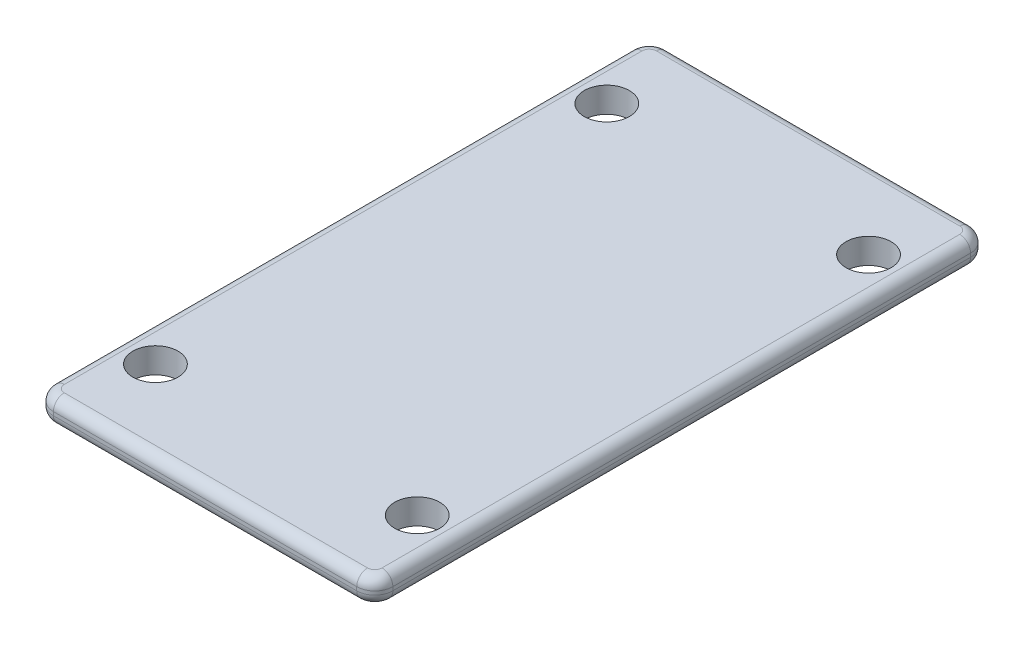
from build123d import *

# Parameters (mm, degrees)
SKETCH1_W                 = 18.8
SKETCH1_H                 = 34
SKETCH1_R                 = 1.25
CABLE_PLATE_EXTRUDE_DEPTH = 1.4
FILLET2_R                 = 1
FILLET1_R                 = 0.6


with BuildPart() as part:
    # Sketch1 → Cable Plate Extrude (new body)
    with BuildSketch(Plane(origin=(0, 0, 0), x_dir=(1, 0, 0), z_dir=(0, 1, 0))):
        Rectangle(SKETCH1_W, SKETCH1_H)
        with Locations(Location((-7.25, 12.5, 0), (0, 0, 270))):
            Circle(SKETCH1_R, mode=Mode.SUBTRACT)
        with Locations(Location((7.25, 12.5, 0), (0, 0, 270))):
            Circle(SKETCH1_R, mode=Mode.SUBTRACT)
        with Locations(Location((-7.25, -12.5, 0), (0, 0, 270))):
            Circle(SKETCH1_R, mode=Mode.SUBTRACT)
        with Locations(Location((7.25, -12.5, 0), (0, 0, 270))):
            Circle(SKETCH1_R, mode=Mode.SUBTRACT)
    extrude(amount=CABLE_PLATE_EXTRUDE_DEPTH)

    # Fillet2
    fillet2_edges = [part.edges().sort_by_distance(p)[0] for p in [
        (-9.4, 0.7, -17),
        (9.4, 0.7, -17),
        (9.4, 0.7, 17),
        (-9.4, 0.7, 17),
    ]]
    fillet(fillet2_edges, radius=FILLET2_R)

    # Fillet1
    fillet1_edges = [part.edges().sort_by_distance(p)[0] for p in [
        (0, 0, 17),
        (0, 1.4, 17),
        (-9.4, 0, 0),
        (0, 0, -17),
        (9.4, 0, 0),
        (-9.107106781, 0, -16.707106781),
        (9.107106781, 0, -16.707106781),
        (9.107106781, 0, 16.707106781),
        (-9.107106781, 0, 16.707106781),
        (-9.4, 1.4, 0),
        (9.4, 1.4, 0),
        (0, 1.4, -17),
        (-9.107106781, 1.4, -16.707106781),
        (9.107106781, 1.4, -16.707106781),
        (9.107106781, 1.4, 16.707106781),
        (-9.107106781, 1.4, 16.707106781),
    ]]
    fillet(fillet1_edges, radius=FILLET1_R)


solid = part.part
